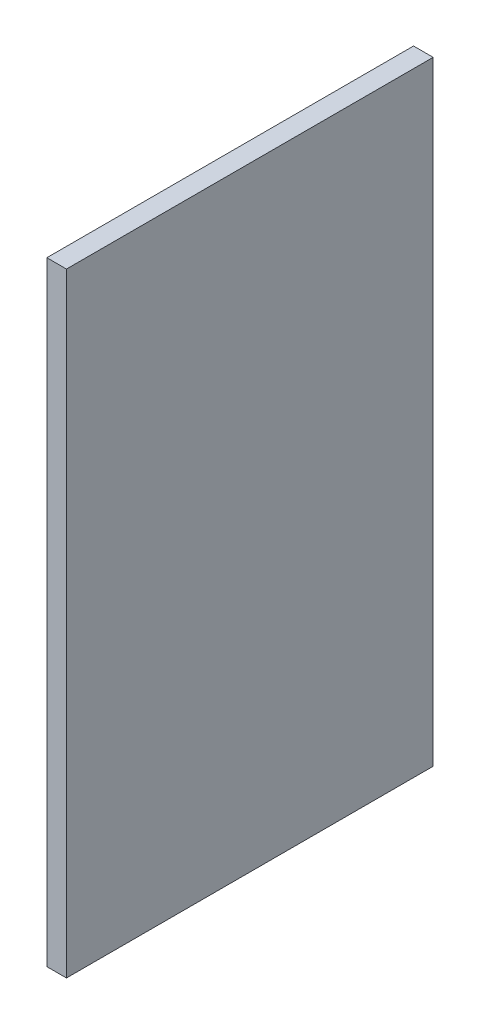
from build123d import *

# Parameters (mm, degrees)
SKETCH1_W           = 341.3125
SKETCH1_H           = 571.5
BOSS_EXTRUDE1_DEPTH = 18.25625


with BuildPart() as part:
    # Sketch1 → Boss-Extrude1 (new body)
    with BuildSketch(Plane(origin=(0, 0, 0), x_dir=(0, 0, -1), z_dir=(1, 0, 0))):
        with Locations((-170.65625, 285.75)):
            Rectangle(SKETCH1_W, SKETCH1_H)
    extrude(amount=BOSS_EXTRUDE1_DEPTH)


solid = part.part
